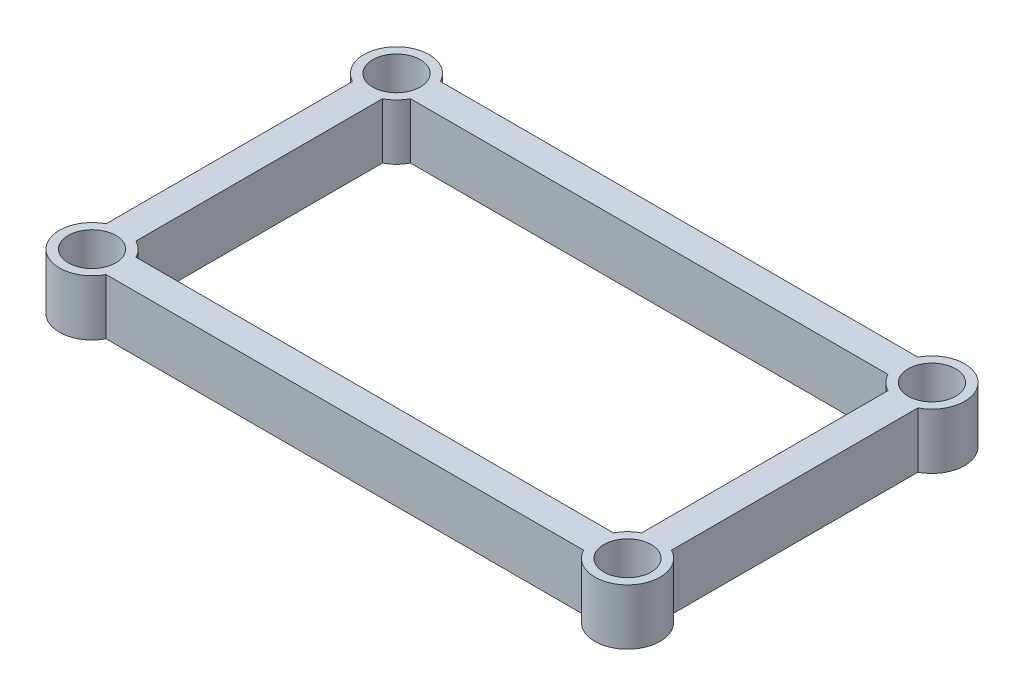
from build123d import *

# Parameters (mm, degrees)
SKETCH1_W           = 416
SKETCH1_H           = 246
BOSS_EXTRUDE1_DEPTH = 20.5
SKETCH2_W           = 372
SKETCH2_H           = 202
CUT_EXTRUDE1_DEPTH  = 30
SKETCH3_R           = 24
BOSS_EXTRUDE2_DEPTH = 20.5
SKETCH4_R           = 17.5
CUT_EXTRUDE2_DEPTH  = 30


with BuildPart() as part:
    # Sketch1 → Boss-Extrude1 (new, symmetric)
    with BuildSketch(Plane(origin=(0, 0, 0), x_dir=(1, 0, 0), z_dir=(0, 1, 0))):
        Rectangle(SKETCH1_W, SKETCH1_H)
    extrude(amount=BOSS_EXTRUDE1_DEPTH, both=True)

    # Sketch2 → Cut-Extrude1 (cut, symmetric)
    with BuildSketch(Plane(origin=(0, 0, 0), x_dir=(1, 0, 0), z_dir=(0, 1, 0))):
        Rectangle(SKETCH2_W, SKETCH2_H)
    extrude(amount=CUT_EXTRUDE1_DEPTH, both=True, mode=Mode.SUBTRACT)

    # Sketch3 → Boss-Extrude2 (add, symmetric)
    with BuildSketch(Plane(origin=(0, 0, 0), x_dir=(1, 0, 0), z_dir=(0, 1, 0))):
        with Locations((-197, -112)):
            Circle(SKETCH3_R)
        with Locations((-197, 112)):
            Circle(SKETCH3_R)
        with Locations((197, -112)):
            Circle(SKETCH3_R)
        with Locations((197, 112)):
            Circle(SKETCH3_R)
    extrude(amount=BOSS_EXTRUDE2_DEPTH, both=True)

    # Sketch4 → Cut-Extrude2 (cut, symmetric)
    with BuildSketch(Plane(origin=(0, 0, 0), x_dir=(1, 0, 0), z_dir=(0, 1, 0))):
        with Locations(Location((-197, -112, 0), (0, 0, 270))):
            Circle(SKETCH4_R)
        with Locations(Location((-197, 112, 0), (0, 0, 270))):
            Circle(SKETCH4_R)
        with Locations(Location((197, -112, 0), (0, 0, 270))):
            Circle(SKETCH4_R)
        with Locations(Location((197, 112, 0), (0, 0, 270))):
            Circle(SKETCH4_R)
    extrude(amount=CUT_EXTRUDE2_DEPTH, both=True, mode=Mode.SUBTRACT)


solid = part.part
